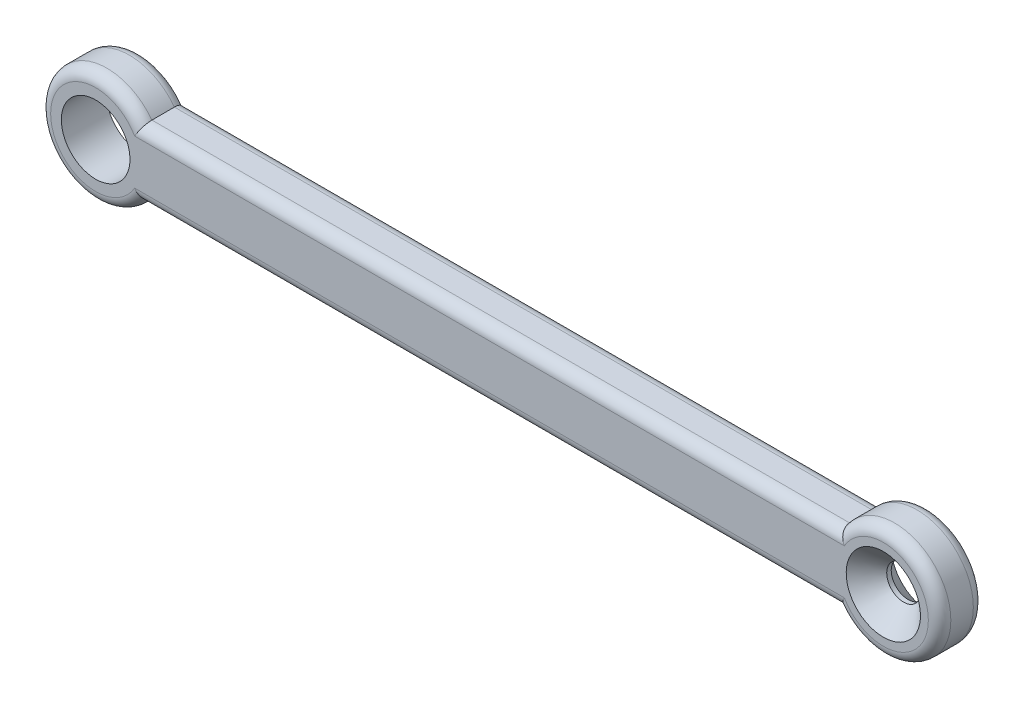
from build123d import *

# Parameters (mm, degrees)
BOSS_EXTRU_1_DEPTH              = 4
DIAM_TRE_DU_PER_AGE_6_1_6_1_1_D = 6.1
CONG_1_R                        = 1


with BuildPart() as part:
    # Esquisse1 → Boss.-Extru.1 (new body)
    with BuildSketch(Plane(origin=(0, 2, 0), x_dir=(1, 0, 0), z_dir=(0, 0, -1))):
        with BuildLine():
            Line((-31, -1), (31, -1))
            ThreePointArc((31, -1), (40, 2), (31, 5))
            Line((31, 5), (-31, 5))
            ThreePointArc((-31, 5), (-40, 2), (-31, -1))
        make_face()
    extrude(amount=-BOSS_EXTRU_1_DEPTH)

    # Diamètre du perçage Ø6.1 (6.1)1 (through all)
    with Locations(Plane(origin=(0, 0, 4), x_dir=(-1, 0, 0), z_dir=(0, 0, 1))):
        with Locations((35, 0)):
            Hole(DIAM_TRE_DU_PER_AGE_6_1_6_1_1_D / 2)

    # Esquisse4 → Fraisage pour vis à tête fraisée M2.51 (revolve, cut)
    with BuildSketch(Plane(origin=(35, 0, 4), x_dir=(0, -1, 0), z_dir=(1, 0, 0))):
        Polygon((0, 0), (0, 4), (3.3, 4), (1.5, 2.2), (1.5, 1.8), (3.3, 0), align=None)
    revolve(axis=Axis((35, 0, 10.35), (0, 0, -1)), mode=Mode.SUBTRACT)

    # Congé1
    cong_1_edges = [part.edges().sort_by_distance(p)[0] for p in [
        (40, 0, 4),
        (0, -3, 4),
        (-40, 0, 4),
        (0, -3, 0),
        (40, 0, 0),
        (0, 3, 0),
        (-40, 0, 0),
        (0, 3, 4),
    ]]
    fillet(cong_1_edges, radius=CONG_1_R)


solid = part.part
